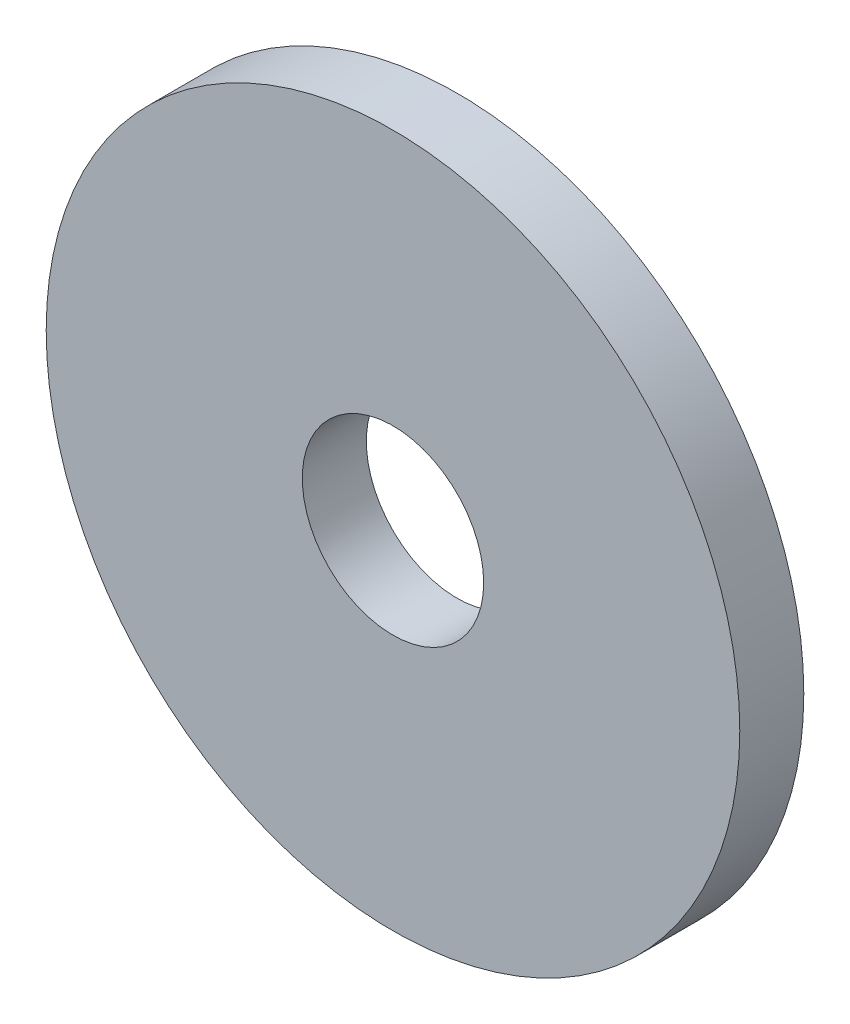
from build123d import *

# Parameters (mm, degrees)
SKETCH_1_R      = 32.5
SKETCH_1_R_2    = 8.5
EXTRUDE_1_DEPTH = 6


with BuildPart() as part:
    # 草图1 → 凸台-拉伸1 (new body)
    with BuildSketch(Plane.XY):
        Circle(SKETCH_1_R)
        Circle(SKETCH_1_R_2, mode=Mode.SUBTRACT)
    extrude(amount=EXTRUDE_1_DEPTH)


solid = part.part
